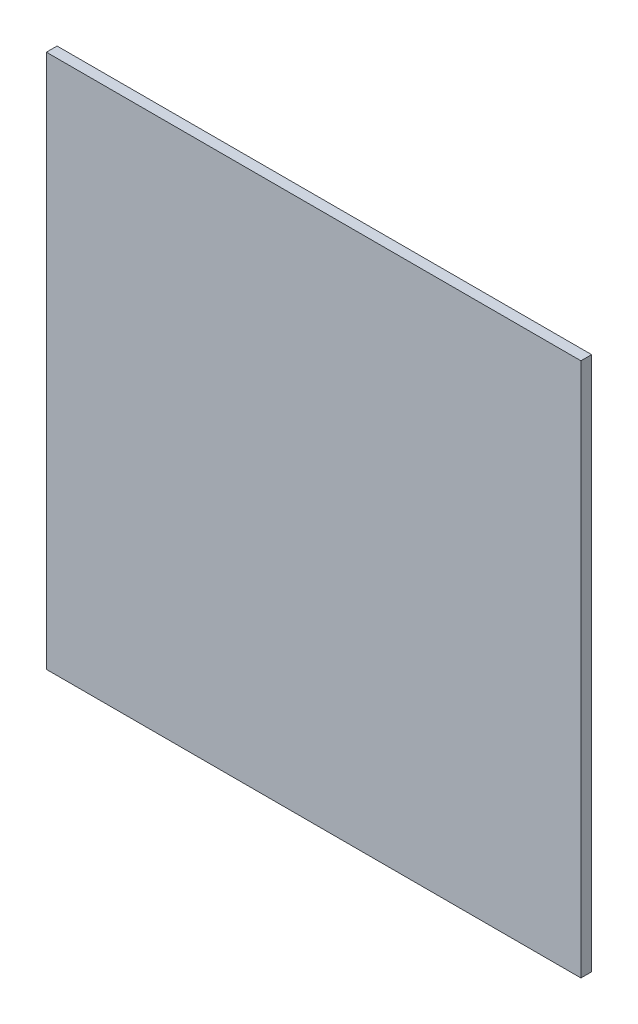
from build123d import *

# Parameters (mm, degrees)
CROQUIS1_W              = 100
CROQUIS1_H              = 100
SALIENTE_EXTRUIR1_DEPTH = 2


with BuildPart() as part:
    # Croquis1 → Saliente-Extruir1 (new body)
    with BuildSketch(Plane.XY):
        with Locations((50, 50)):
            Rectangle(CROQUIS1_W, CROQUIS1_H)
    extrude(amount=SALIENTE_EXTRUIR1_DEPTH)


solid = part.part
